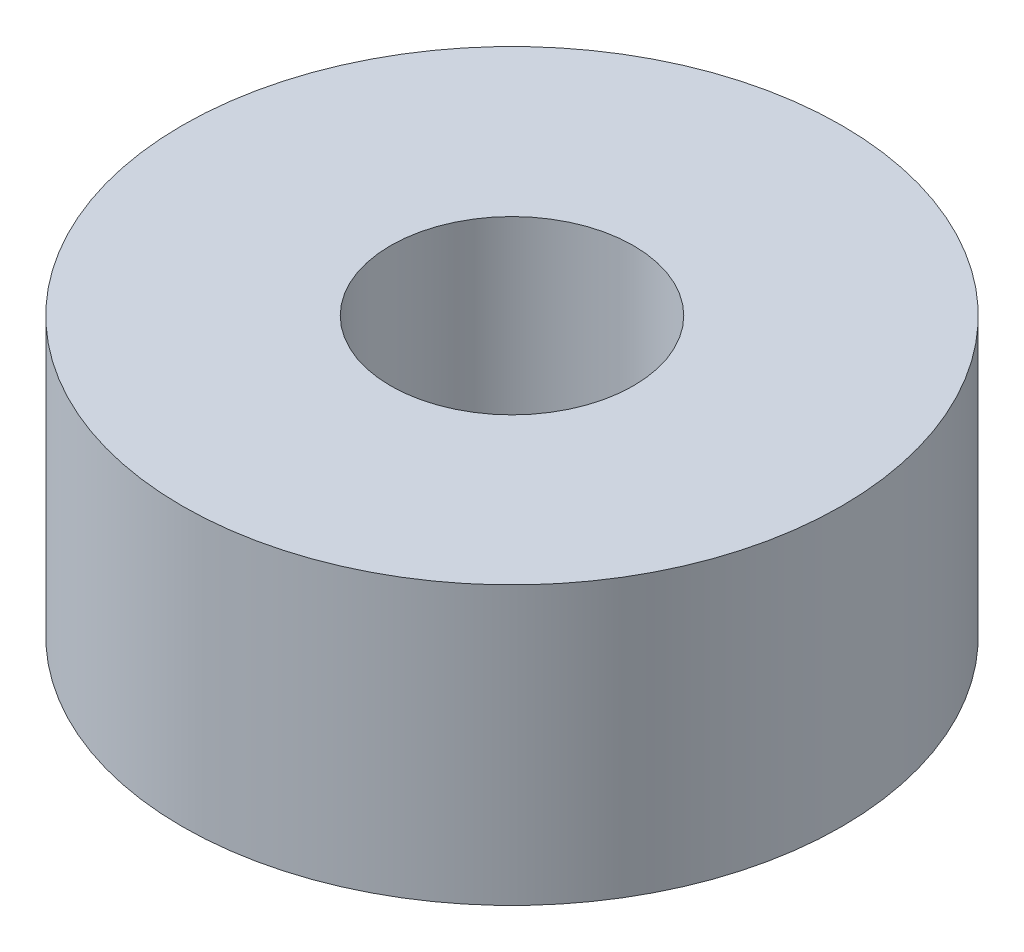
from build123d import *

# Parameters (mm, degrees)
SKETCH1_R           = 4.75
BOSS_EXTRUDE1_DEPTH = 4
SKETCH2_R           = 1.75
CUT_EXTRUDE1_DEPTH  = 8.818247886


with BuildPart() as part:
    # Sketch1 → Boss-Extrude1 (new body)
    with BuildSketch(Plane(origin=(0, 0, 0), x_dir=(1, 0, 0), z_dir=(0, 1, 0))):
        with Locations(Location((0, 0, 0), (0, 0, 270))):
            Circle(SKETCH1_R)
    extrude(amount=BOSS_EXTRUDE1_DEPTH)

    # Sketch2 → Cut-Extrude1 (cut, through all)
    with BuildSketch(Plane(origin=(0, 4, 0), x_dir=(1, 0, 0), z_dir=(0, 1, 0))):
        with Locations(Location((0, 0, 0), (0, 0, 270))):
            Circle(SKETCH2_R)
    extrude(amount=-CUT_EXTRUDE1_DEPTH, mode=Mode.SUBTRACT)


solid = part.part
